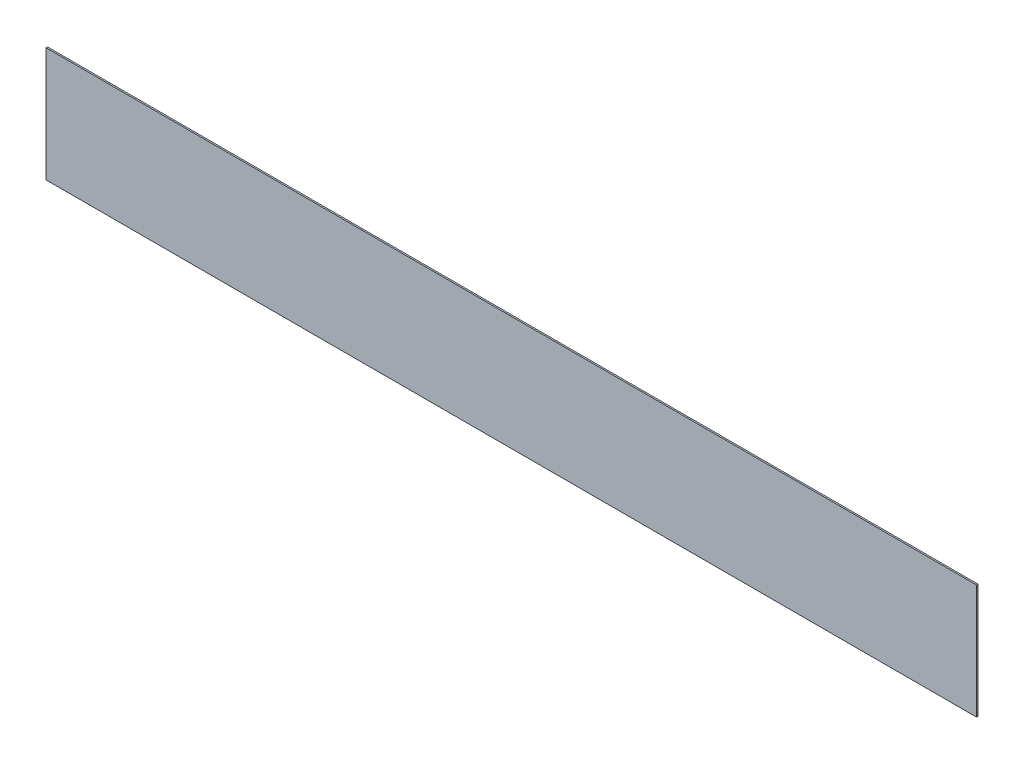
from build123d import *

# Parameters (mm, degrees)
SKETCH1_W           = 813
SKETCH1_H           = 100
BOSS_EXTRUDE1_DEPTH = 1.27


with BuildPart() as part:
    # Sketch1 → Boss-Extrude1 (new body)
    with BuildSketch(Plane.XY):
        with Locations((406.5, 50)):
            Rectangle(SKETCH1_W, SKETCH1_H)
    extrude(amount=BOSS_EXTRUDE1_DEPTH)


solid = part.part
